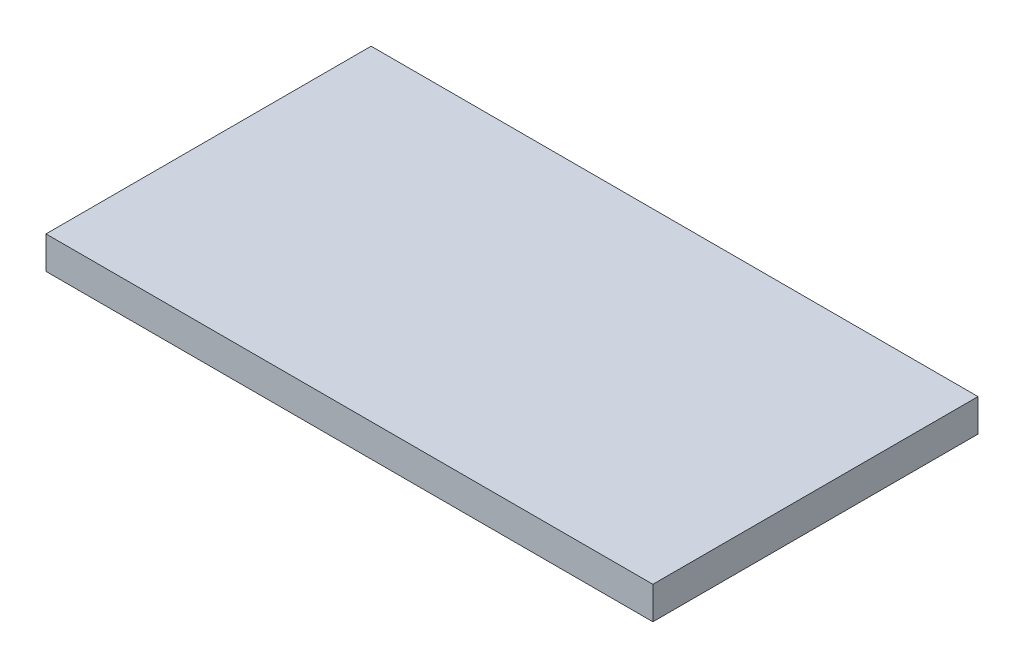
from build123d import *

# Parameters (mm, degrees)
SKETCH1_W           = 1422.4
SKETCH1_H           = 762
BOSS_EXTRUDE1_DEPTH = 76.2
SKETCH3_W           = 101.6
SKETCH3_H           = 101.6
CUT_EXTRUDE1_DEPTH  = 38.1


with BuildPart() as part:
    # Sketch1 → Boss-Extrude1 (new body)
    with BuildSketch(Plane(origin=(0, 0, 0), x_dir=(1, 0, 0), z_dir=(0, 1, 0))):
        with Locations((711.2, 381)):
            Rectangle(SKETCH1_W, SKETCH1_H)
    extrude(amount=BOSS_EXTRUDE1_DEPTH)

    # Sketch3 → Cut-Extrude1 (cut)
    with BuildSketch(Plane.XZ):
        with Locations((152.4, -101.6)):
            Rectangle(SKETCH3_W, SKETCH3_H)
        with Locations((152.4, -660.4)):
            Rectangle(SKETCH3_W, SKETCH3_H)
        with Locations((1270, -101.6)):
            Rectangle(SKETCH3_W, SKETCH3_H)
        with Locations((1270, -660.4)):
            Rectangle(SKETCH3_W, SKETCH3_H)
    extrude(amount=-CUT_EXTRUDE1_DEPTH, mode=Mode.SUBTRACT)


solid = part.part
